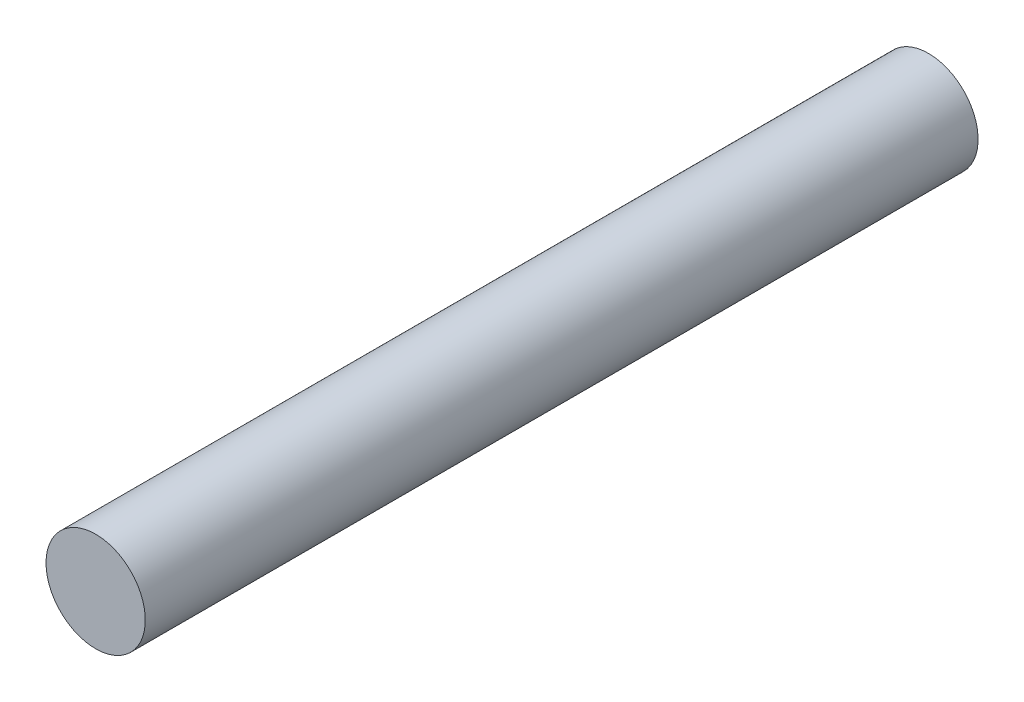
from build123d import *

# Parameters (mm, degrees)
SKETCH_1_R      = 3.1
EXTRUDE_1_DEPTH = 52


with BuildPart() as part:
    # 草图1 → 凸台-拉伸1 (new body)
    with BuildSketch(Plane.XY):
        with Locations(Location((0, 0, 0), (0, 0, 180))):
            Circle(SKETCH_1_R)
    extrude(amount=EXTRUDE_1_DEPTH)


solid = part.part
